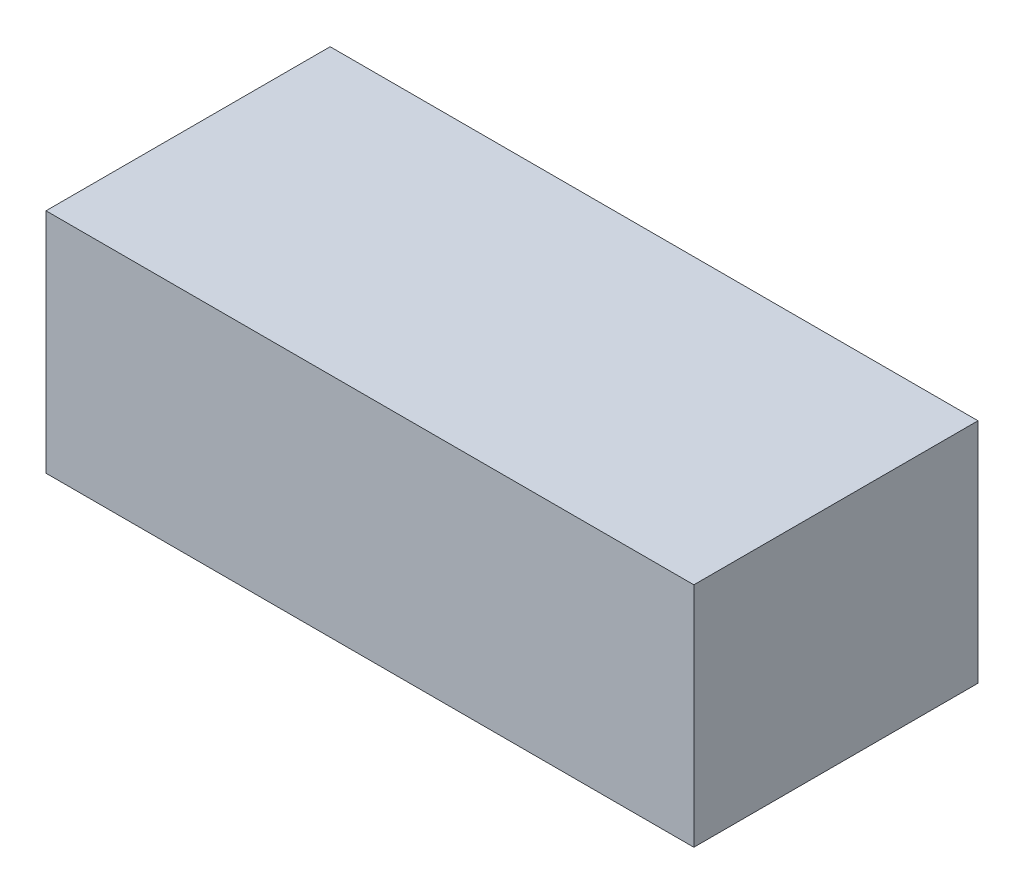
from build123d import *

# Parameters (mm, degrees)
SKETCH2_W           = 57
SKETCH2_H           = 25
BOSS_EXTRUDE1_DEPTH = 20


with BuildPart() as part:
    # Sketch2 → Boss-Extrude1 (new body)
    with BuildSketch(Plane(origin=(0, 0, 0), x_dir=(1, 0, 0), z_dir=(0, 1, 0))):
        Rectangle(SKETCH2_W, SKETCH2_H)
    extrude(amount=BOSS_EXTRUDE1_DEPTH)


solid = part.part
